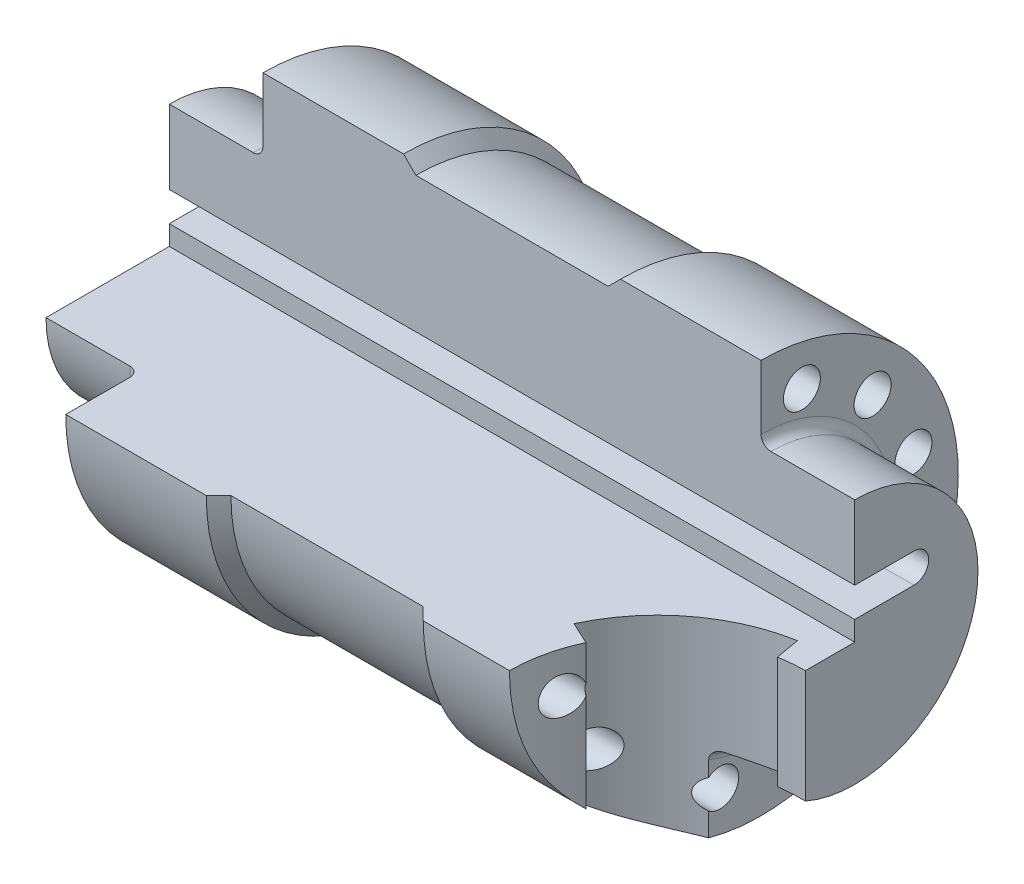
from build123d import *

# Parameters (mm, degrees)
SKETCH2_W          = 44.887778639
SKETCH2_H          = 40.820436252
CUT_EXTRUDE1_DEPTH = 151.069983674
CUT_EXTRUDE2_DEPTH = 151.069983674
SKETCH5_R          = 3.75
CUT_EXTRUDE3_DEPTH = 133.664991614
CUT_EXTRUDE4_DEPTH = 151.069983674
CUT_EXTRUDE5_DEPTH = 10
FILLET1_R          = 1


with BuildPart() as part:
    # Sketch1 → Revolve1 (revolve)
    with BuildSketch(Plane.XY, mode=Mode.PRIVATE) as revolve1_sk:
        with BuildLine():
            Line((0, 0), (139, 0))
            Line((139, 0), (139, 25))
            Line((139, 25), (122, 25))
            ThreePointArc((122, 25), (120.585786438, 25.585786438), (120, 27))
            Line((120, 27), (120, 40))
            Line((120, 40), (91.5, 40))
            Line((91.5, 40), (89, 37.5))
            Line((89, 37.5), (50, 37.5))
            Line((50, 37.5), (47.5, 40))
            Line((47.5, 40), (19, 40))
            Line((19, 40), (19, 27))
            ThreePointArc((19, 27), (18.414213562, 25.585786438), (17, 25))
            Line((17, 25), (0, 25))
            Line((0, 25), (0, 0))
        make_face()
    revolve(revolve1_sk.sketch.rotate(Axis((0, 0, 0), (1, 0, 0)), 90), axis=Axis((0, 0, 0), (1, 0, 0)))

    # Sketch2 → Cut-Extrude1 (cut, through all)
    with BuildSketch(Plane.ZY):
        with Locations((22.44388932, 20.410218126)):
            Rectangle(SKETCH2_W, SKETCH2_H)
    extrude(amount=-CUT_EXTRUDE1_DEPTH, mode=Mode.SUBTRACT)

    # Sketch4 → Cut-Extrude2 (cut, through all)
    with BuildSketch(Plane.ZY):
        with BuildLine():
            Line((0, 4), (-12, 4))
            ThreePointArc((-12, 4), (-15, 7), (-12, 10))
            Line((-12, 10), (0, 10))
            ThreePointArc((0, 10), (3, 7), (0, 4))
        make_face()
    extrude(amount=-CUT_EXTRUDE2_DEPTH, mode=Mode.SUBTRACT)

    # Sketch5 → Cut-Extrude3 (cut, through all)
    with BuildSketch(Plane.ZY.offset(-19)):
        with Locations((-8.282209443, 30.909626441)):
            Circle(SKETCH5_R)
        with Locations((-22.62297233, 22.626635765)):
            Circle(SKETCH5_R)
        with Locations((-30.901659317, 8.283387998)):
            Circle(SKETCH5_R)
        with Locations((-30.90041693, -8.277572517)):
            Circle(SKETCH5_R)
        with Locations((-22.619578006, -22.619578006)):
            Circle(SKETCH5_R)
        with Locations((-8.277572517, -30.90041693)):
            Circle(SKETCH5_R)
        with Locations((8.283387998, -30.901659317)):
            Circle(SKETCH5_R)
        with Locations((22.626635765, -22.62297233)):
            Circle(SKETCH5_R)
        with Locations((30.909626441, -8.282209443)):
            Circle(SKETCH5_R)
    extrude(amount=-CUT_EXTRUDE3_DEPTH, mode=Mode.SUBTRACT)

    # Sketch6 → Cut-Extrude4 (cut, through all)
    with BuildSketch(Plane(origin=(0, 0, 0), x_dir=(1, 0, 0), z_dir=(0, 1, 0))):
        with BuildLine():
            Line((107.279227454, -25.208360839), (111.810766389, -27.321452148))
            ThreePointArc((111.810766389, -27.321452148), (157.26284287, -63.800600209), (133.79055467, -10.45576741))
            Line((133.79055467, -10.45576741), (132.922313782, -5.531728645))
            ThreePointArc((132.922313782, -5.531728645), (117.693349985, -12.23263309), (107.279227454, -25.208360839))
        make_face()
    extrude(amount=-CUT_EXTRUDE4_DEPTH, mode=Mode.SUBTRACT)

    # Sketch7 → Cut-Extrude5 (cut)
    with BuildSketch(Plane.ZY):
        with BuildLine():
            Line((-4, 0), (-21, 0))
            ThreePointArc((-21, 0), (-2.009217424, -20.903661051), (20.615528128, -4))
            Line((20.615528128, -4), (-4, -4))
            Line((-4, -4), (-4, 0))
        make_face()
    extrude(amount=-CUT_EXTRUDE5_DEPTH, mode=Mode.SUBTRACT)

    # Fillet1
    fillet1_edges = [part.edges().sort_by_distance(p)[0] for p in [
        (10, -2, -4),
        (10, -4, 8.307764064),
        (10, -20.903661051, -2.009217424),
        (10, 0, -12.5),
        (0, -2, -4),
        (0, 0, -12.5),
        (0, -20.903661051, -2.009217424),
        (0, -4, 8.307764064),
    ]]
    fillet(fillet1_edges, radius=FILLET1_R)


solid = part.part
